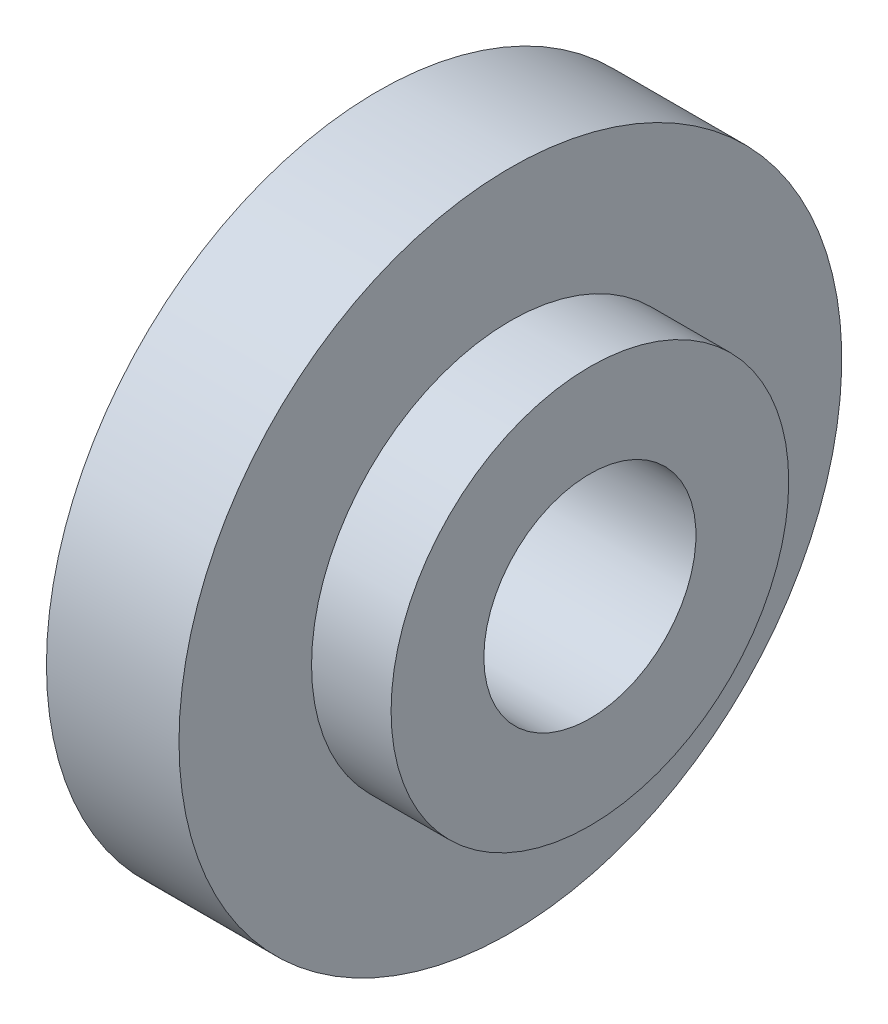
from build123d import *


with BuildPart() as part:
    # 草图1 → 旋转1 (revolve)
    with BuildSketch(Plane(origin=(0, 0, 0), x_dir=(1, 0, 0), z_dir=(0, 1, 0)), mode=Mode.PRIVATE) as revolve_1_sk:
        Polygon((0, 4), (0, 12.5), (5, 12.5), (5, 7.5), (8, 7.5), (8, 4), align=None)
    revolve(revolve_1_sk.sketch.rotate(Axis((0, 0, 0), (1, 0, 0)), 180), axis=Axis((0, 0, 0), (1, 0, 0)))


solid = part.part
